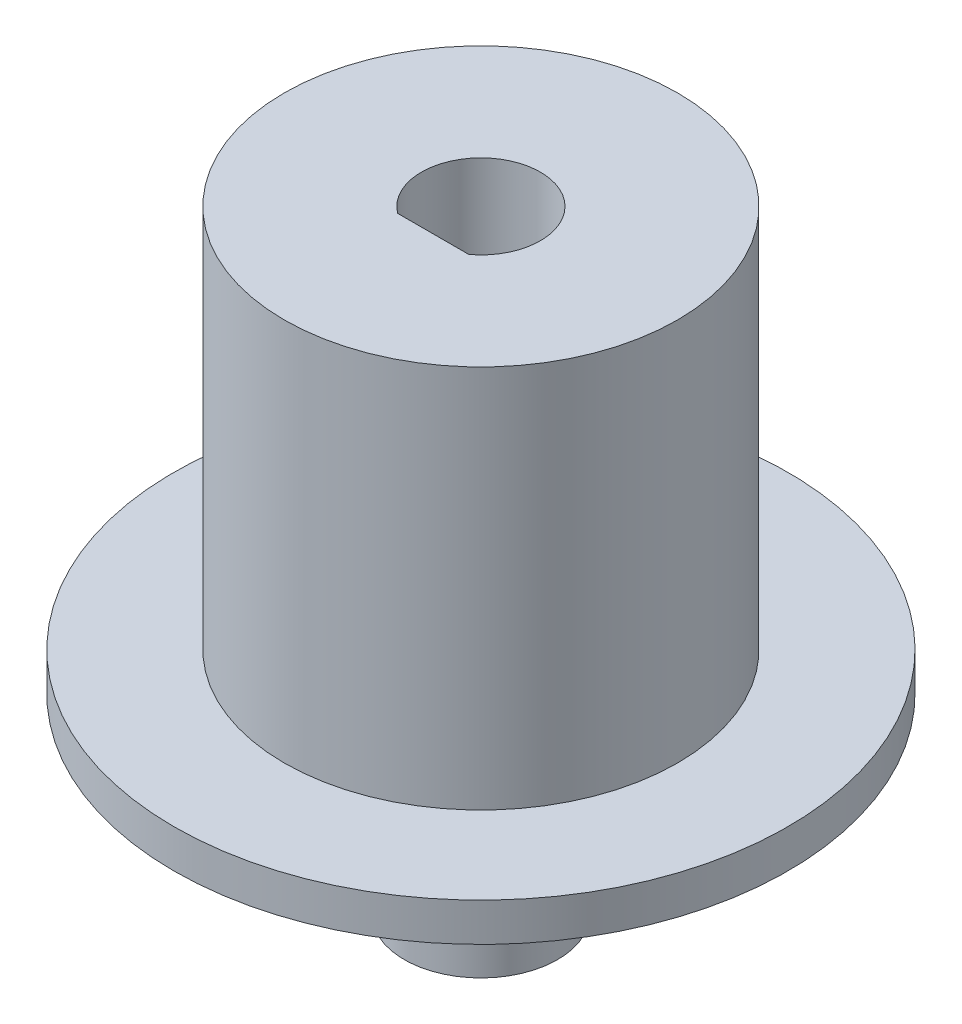
from build123d import *

# Parameters (mm, degrees)
SKETCH1_R               = 16
BOSS_EXTRUDE1_DEPTH     = 2
SKETCH2_R               = 10.25
BOSS_EXTRUDE2_DEPTH     = 20
SKETCH4_R               = 4
BOSS_EXTRUDE3_DEPTH     = 10
CUT_EXTRUDE1_DEPTH      = 32.559467676
CUT_EXTRUDE1_DEPTH_BACK = 32.559467676


with BuildPart() as part:
    # Sketch1 → Boss-Extrude1 (new body)
    with BuildSketch(Plane(origin=(0, 0, 0), x_dir=(1, 0, 0), z_dir=(0, 1, 0))):
        with Locations(Location((0, 0, 0), (0, 0, 270))):
            Circle(SKETCH1_R)
    extrude(amount=BOSS_EXTRUDE1_DEPTH)

    # Sketch2 → Boss-Extrude2 (add)
    with BuildSketch(Plane(origin=(0, 2, 0), x_dir=(1, 0, 0), z_dir=(0, 1, 0))):
        with Locations(Location((0, 0, 0), (0, 0, 270))):
            Circle(SKETCH2_R)
    extrude(amount=BOSS_EXTRUDE2_DEPTH)

    # Sketch4 → Boss-Extrude3 (add)
    with BuildSketch(Plane.XZ):
        with Locations(Location((0, 0, 0), (0, 0, 270))):
            Circle(SKETCH4_R)
    extrude(amount=BOSS_EXTRUDE3_DEPTH)

    # Sketch3 → Cut-Extrude1 (cut, two sides: drawn at the far end of the back side and taken through both)
    with BuildSketch(Plane.XZ.offset(-CUT_EXTRUDE1_DEPTH_BACK)):
        with BuildLine():
            Line((0, 2.484658643), (0, -3.1))
            ThreePointArc((0, -3.1), (2.192031022, -2.192031022), (3.1, 0))
            ThreePointArc((3.1, 0), (2.770983027, 1.389839223), (1.853772215, 2.484658643))
            Line((1.853772215, 2.484658643), (0, 2.484658643))
        make_face()
        with BuildLine():
            ThreePointArc((-1.853772215, 2.484658643), (-2.942145628, -0.976616149), (0, -3.1))
            Line((0, -3.1), (0, 2.484658643))
            Line((0, 2.484658643), (-1.853772215, 2.484658643))
        make_face()
    extrude(amount=CUT_EXTRUDE1_DEPTH + CUT_EXTRUDE1_DEPTH_BACK, mode=Mode.SUBTRACT)


solid = part.part
